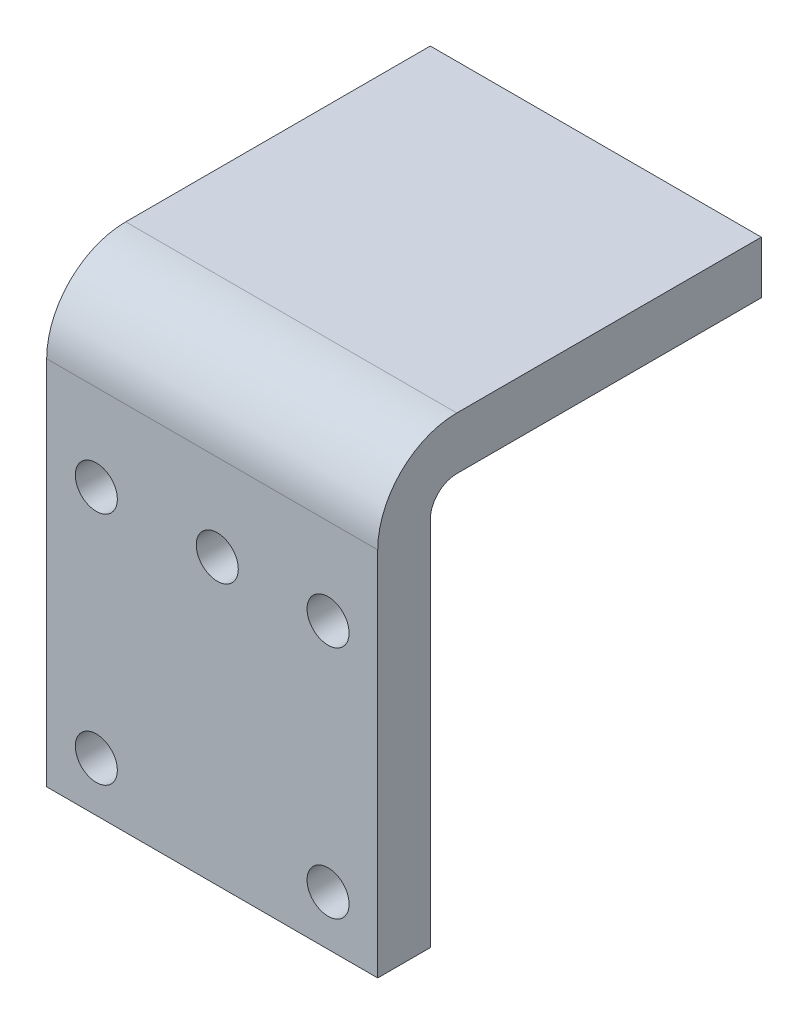
from build123d import *

# Parameters (mm, degrees)
SALIENTE_EXTRUIR1_DEPTH = 100
CROQUIS2_R              = 6.35
CORTAR_EXTRUIR1_DEPTH   = 100


with BuildPart() as part:
    # Croquis1 → Saliente-Extruir1 (new body)
    with BuildSketch(Plane(origin=(0, 0, 0), x_dir=(0, 0, -1), z_dir=(1, 0, 0))):
        with BuildLine():
            Line((8, 0), (100, 0))
            Line((100, 0), (100, 15.875))
            Line((100, 15.875), (8, 15.875))
            ThreePointArc((8, 15.875), (-8.882174401, 8.882174401), (-15.875, -8))
            Line((-15.875, -8), (-15.875, -120))
            Line((-15.875, -120), (0, -120))
            Line((0, -120), (0, -8))
            ThreePointArc((0, -8), (2.343145751, -2.343145751), (8, 0))
        make_face()
    extrude(amount=SALIENTE_EXTRUIR1_DEPTH)

    # Croquis2 → Cortar-Extruir1 (cut)
    with BuildSketch(Plane.XY.offset(15.875)):
        with Locations((15, -34.089894909)):
            Circle(CROQUIS2_R)
        with Locations((85, -34.089894909)):
            Circle(CROQUIS2_R)
        with Locations((15, -105)):
            Circle(CROQUIS2_R)
        with Locations((85, -105)):
            Circle(CROQUIS2_R)
        with Locations((51.532189387, -34.089894909)):
            Circle(CROQUIS2_R)
    extrude(amount=-CORTAR_EXTRUIR1_DEPTH, mode=Mode.SUBTRACT)


solid = part.part
